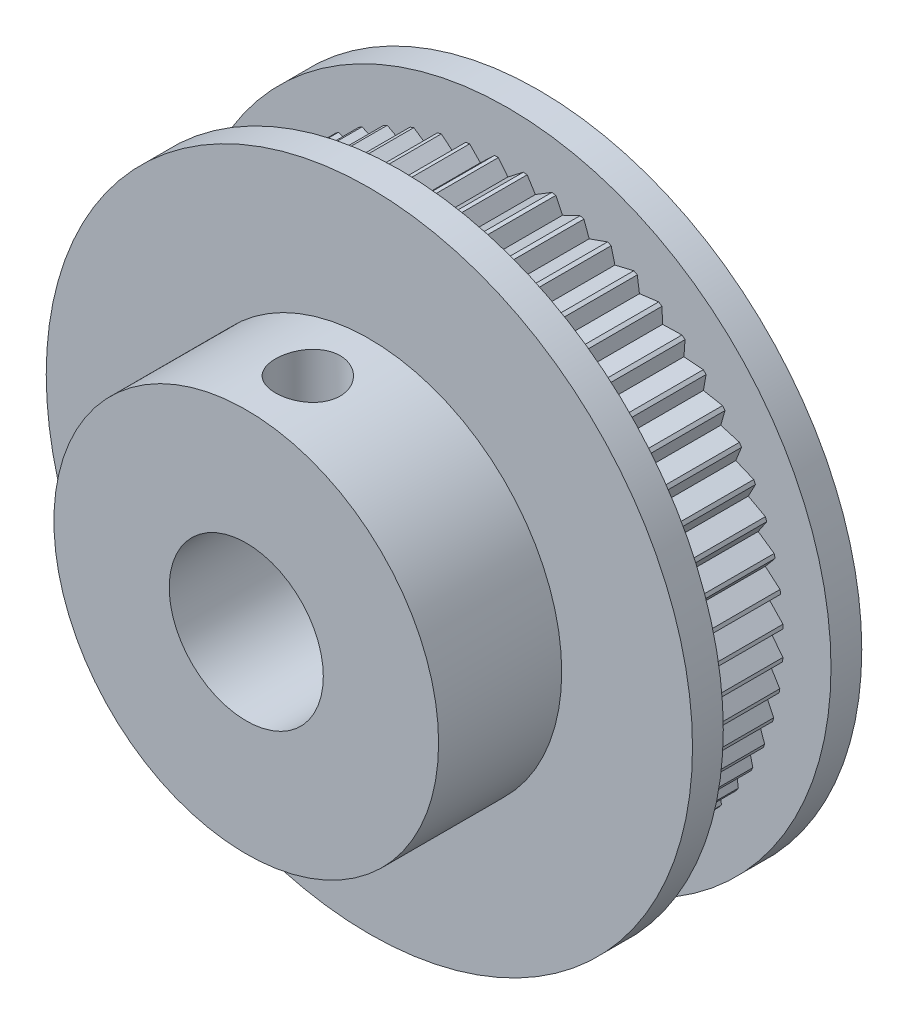
from build123d import *

# Parameters (mm, degrees)
SKETCH1_R                 = 21
BOSS_EXTRUDE1_DEPTH       = 11
SKETCH2_R                 = 12.5
BOSS_EXTRUDE2_DEPTH       = 8
SKETCH3_R                 = 5.0075
CUT_EXTRUDE1_DEPTH        = 20
CUT_EXTRUDE5_START        = -2
CUT_EXTRUDE5_DEPTH        = 7
CUT_EXTRUDE6_START        = -2
SKETCH5_R                 = 21.042635215
SKETCH5_R_2               = 17.9
CUT_EXTRUDE6_DEPTH        = 7
M5X0_8_TAPPED_HOLE1_D     = 4.2
M5X0_8_TAPPED_HOLE1_DEPTH = 14
M5X0_8_TAPPED_HOLE1_TIP   = 1.2618073


with BuildPart() as part:
    # Sketch1 → Boss-Extrude1 (new body)
    with BuildSketch(Plane.XY):
        Circle(SKETCH1_R)
    extrude(amount=BOSS_EXTRUDE1_DEPTH)

    # Sketch2 → Boss-Extrude2 (add)
    with BuildSketch(Plane.XY.offset(11)):
        Circle(SKETCH2_R)
    extrude(amount=BOSS_EXTRUDE2_DEPTH)

    # Sketch3 → Cut-Extrude1 (cut)
    with BuildSketch(Plane.XY.offset(19)):
        Circle(SKETCH3_R)
    extrude(amount=-CUT_EXTRUDE1_DEPTH, mode=Mode.SUBTRACT)

    # Sketch4 → Cut-Extrude5 (cut)
    with BuildSketch(Plane.XY.offset(11).offset(CUT_EXTRUDE5_START)):
        Polygon((0, 17.103839282), (1.167293613, 18), (-0.703728041, 18), align=None)
        Polygon((1.787838036, 17.010142661), (3.042411396, 17.779378709), (1.181639394, 17.974953727), align=None)
        Polygon((3.556088145, 16.730079357), (4.884195882, 17.363962824), (3.05406054, 17.7529701), align=None)
        Polygon((5.285377007, 16.266717803), (6.672468096, 16.758303729), (4.89302076, 17.336481217), align=None)
        Polygon((6.956758173, 15.625134685), (8.387635354, 15.969037152), (6.67837202, 16.730050218), align=None)
        Polygon((8.551919641, 14.812359321), (10.010905923, 15.004810461), (8.390553639, 15.940321288), align=None)
        Polygon((10.053384488, 13.837296649), (11.524494912, 13.876187928), (10.010806597, 14.975946863), align=None)
        Polygon((11.44470235, 12.710629659), (12.911819123, 12.595534975), (11.521379062, 13.847492829), align=None)
        Polygon((12.710629659, 11.44470235), (14.157678742, 11.176882706), (12.905720888, 12.567322766), align=None)
        Polygon((13.837296649, 10.053384488), (15.24842387, 9.635774171), (14.148664935, 11.149462486), align=None)
        Polygon((14.812359321, 8.551919641), (16.172104075, 7.989094077), (15.236593248, 9.609446361), align=None)
        Polygon((15.625134685, 6.956758173), (16.918599323, 6.254883797), (16.157586257, 7.96414713), align=None)
        Polygon((16.266717803, 5.285377007), (17.479730857, 4.452143701), (16.901553369, 6.231591038), align=None)
        Polygon((16.730079357, 3.556088145), (17.849350802, 2.600624987), (17.460343526, 4.430760329), align=None)
        Polygon((17.010142661, 1.787838036), (18.023409524, 0.720613282), (17.827834506, 2.581385284), align=None)
        Polygon((17.103839282, 0), (18, -1.167293613), (18, 0.703728041), align=None)
        Polygon((17.010142661, -1.787838036), (17.779378709, -3.042411396), (17.974953727, -1.181639394), align=None)
        Polygon((16.730079357, -3.556088145), (17.363962824, -4.884195882), (17.7529701, -3.05406054), align=None)
        Polygon((16.266717803, -5.285377007), (16.758303729, -6.672468096), (17.336481217, -4.89302076), align=None)
        Polygon((15.625134685, -6.956758173), (15.969037152, -8.387635354), (16.730050218, -6.67837202), align=None)
        Polygon((14.812359321, -8.551919641), (15.004810461, -10.010905923), (15.940321288, -8.390553639), align=None)
        Polygon((13.837296649, -10.053384488), (13.876187928, -11.524494912), (14.975946863, -10.010806597), align=None)
        Polygon((12.710629659, -11.44470235), (12.595534975, -12.911819123), (13.847492829, -11.521379062), align=None)
        Polygon((11.44470235, -12.710629659), (11.176882706, -14.157678742), (12.567322766, -12.905720888), align=None)
        Polygon((10.053384488, -13.837296649), (9.635774171, -15.24842387), (11.149462486, -14.148664935), align=None)
        Polygon((8.551919641, -14.812359321), (7.989094077, -16.172104075), (9.609446361, -15.236593248), align=None)
        Polygon((6.956758173, -15.625134685), (6.254883797, -16.918599323), (7.96414713, -16.157586257), align=None)
        Polygon((5.285377007, -16.266717803), (4.452143701, -17.479730857), (6.231591038, -16.901553369), align=None)
        Polygon((3.556088145, -16.730079357), (2.600624987, -17.849350802), (4.430760329, -17.460343526), align=None)
        Polygon((1.787838036, -17.010142661), (0.720613282, -18.023409524), (2.581385284, -17.827834506), align=None)
        Polygon((0, -17.103839282), (-1.167293613, -18), (0.703728041, -18), align=None)
        Polygon((-1.787838036, -17.010142661), (-3.042411396, -17.779378709), (-1.181639394, -17.974953727), align=None)
        Polygon((-3.556088145, -16.730079357), (-4.884195882, -17.363962824), (-3.05406054, -17.7529701), align=None)
        Polygon((-5.285377007, -16.266717803), (-6.672468096, -16.758303729), (-4.89302076, -17.336481217), align=None)
        Polygon((-6.956758173, -15.625134685), (-8.387635354, -15.969037152), (-6.67837202, -16.730050218), align=None)
        Polygon((-8.551919641, -14.812359321), (-10.010905923, -15.004810461), (-8.390553639, -15.940321288), align=None)
        Polygon((-10.053384488, -13.837296649), (-11.524494912, -13.876187928), (-10.010806597, -14.975946863), align=None)
        Polygon((-11.44470235, -12.710629659), (-12.911819123, -12.595534975), (-11.521379062, -13.847492829), align=None)
        Polygon((-12.710629659, -11.44470235), (-14.157678742, -11.176882706), (-12.905720888, -12.567322766), align=None)
        Polygon((-13.837296649, -10.053384488), (-15.24842387, -9.635774171), (-14.148664935, -11.149462486), align=None)
        Polygon((-14.812359321, -8.551919641), (-16.172104075, -7.989094077), (-15.236593248, -9.609446361), align=None)
        Polygon((-15.625134685, -6.956758173), (-16.918599323, -6.254883797), (-16.157586257, -7.96414713), align=None)
        Polygon((-16.266717803, -5.285377007), (-17.479730857, -4.452143701), (-16.901553369, -6.231591038), align=None)
        Polygon((-16.730079357, -3.556088145), (-17.849350802, -2.600624987), (-17.460343526, -4.430760329), align=None)
        Polygon((-17.010142661, -1.787838036), (-18.023409524, -0.720613282), (-17.827834506, -2.581385284), align=None)
        Polygon((-17.103839282, 0), (-18, 1.167293613), (-18, -0.703728041), align=None)
        Polygon((-17.010142661, 1.787838036), (-17.779378709, 3.042411396), (-17.974953727, 1.181639394), align=None)
        Polygon((-16.730079357, 3.556088145), (-17.363962824, 4.884195882), (-17.7529701, 3.05406054), align=None)
        Polygon((-16.266717803, 5.285377007), (-16.758303729, 6.672468096), (-17.336481217, 4.89302076), align=None)
        Polygon((-15.625134685, 6.956758173), (-15.969037152, 8.387635354), (-16.730050218, 6.67837202), align=None)
        Polygon((-14.812359321, 8.551919641), (-15.004810461, 10.010905923), (-15.940321288, 8.390553639), align=None)
        Polygon((-13.837296649, 10.053384488), (-13.876187928, 11.524494912), (-14.975946863, 10.010806597), align=None)
        Polygon((-12.710629659, 11.44470235), (-12.595534975, 12.911819123), (-13.847492829, 11.521379062), align=None)
        Polygon((-11.44470235, 12.710629659), (-11.176882706, 14.157678742), (-12.567322766, 12.905720888), align=None)
        Polygon((-10.053384488, 13.837296649), (-9.635774171, 15.24842387), (-11.149462486, 14.148664935), align=None)
        Polygon((-8.551919641, 14.812359321), (-7.989094077, 16.172104075), (-9.609446361, 15.236593248), align=None)
        Polygon((-6.956758173, 15.625134685), (-6.254883797, 16.918599323), (-7.96414713, 16.157586257), align=None)
        Polygon((-5.285377007, 16.266717803), (-4.452143701, 17.479730857), (-6.231591038, 16.901553369), align=None)
        Polygon((-3.556088145, 16.730079357), (-2.600624987, 17.849350802), (-4.430760329, 17.460343526), align=None)
        Polygon((-1.787838036, 17.010142661), (-0.720613282, 18.023409524), (-2.581385284, 17.827834506), align=None)
    extrude(amount=-CUT_EXTRUDE5_DEPTH, mode=Mode.SUBTRACT)

    # Sketch5 → Cut-Extrude6 (cut)
    with BuildSketch(Plane.XY.offset(11).offset(CUT_EXTRUDE6_START)):
        Circle(SKETCH5_R)
        Circle(SKETCH5_R_2, mode=Mode.SUBTRACT)
    extrude(amount=-CUT_EXTRUDE6_DEPTH, mode=Mode.SUBTRACT)

    # M5x0.8 Tapped Hole1
    with Locations(Plane(origin=(0, 12.5, 0), x_dir=(1, 0, 0), z_dir=(0, 1, 0))):
        with Locations((0, -15)):
            Hole(M5X0_8_TAPPED_HOLE1_D / 2, depth=M5X0_8_TAPPED_HOLE1_DEPTH)
            with Locations((0, 0, -(M5X0_8_TAPPED_HOLE1_DEPTH + M5X0_8_TAPPED_HOLE1_TIP / 2))):  # 118° drill point
                Cone(0, M5X0_8_TAPPED_HOLE1_D / 2, M5X0_8_TAPPED_HOLE1_TIP, mode=Mode.SUBTRACT)


solid = part.part
